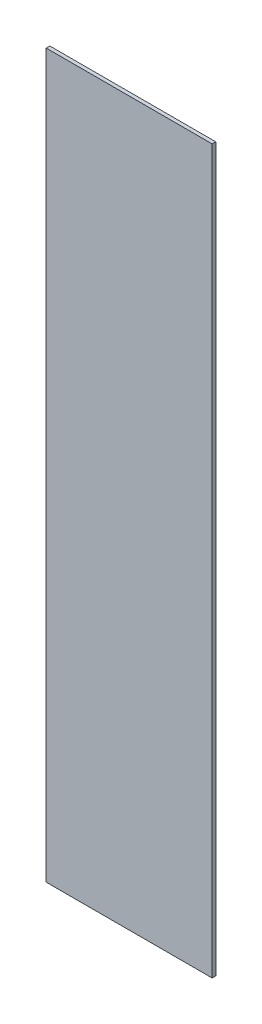
from build123d import *

# Parameters (mm, degrees)
SKETCH1_W           = 91.86
SKETCH1_H           = 2
BOSS_EXTRUDE1_DEPTH = 400


with BuildPart() as part:
    # Sketch1 → Boss-Extrude1 (new body)
    with BuildSketch(Plane(origin=(0, 0, 0), x_dir=(1, 0, 0), z_dir=(0, 1, 0))):
        Rectangle(SKETCH1_W, SKETCH1_H)
    extrude(amount=BOSS_EXTRUDE1_DEPTH)


solid = part.part
